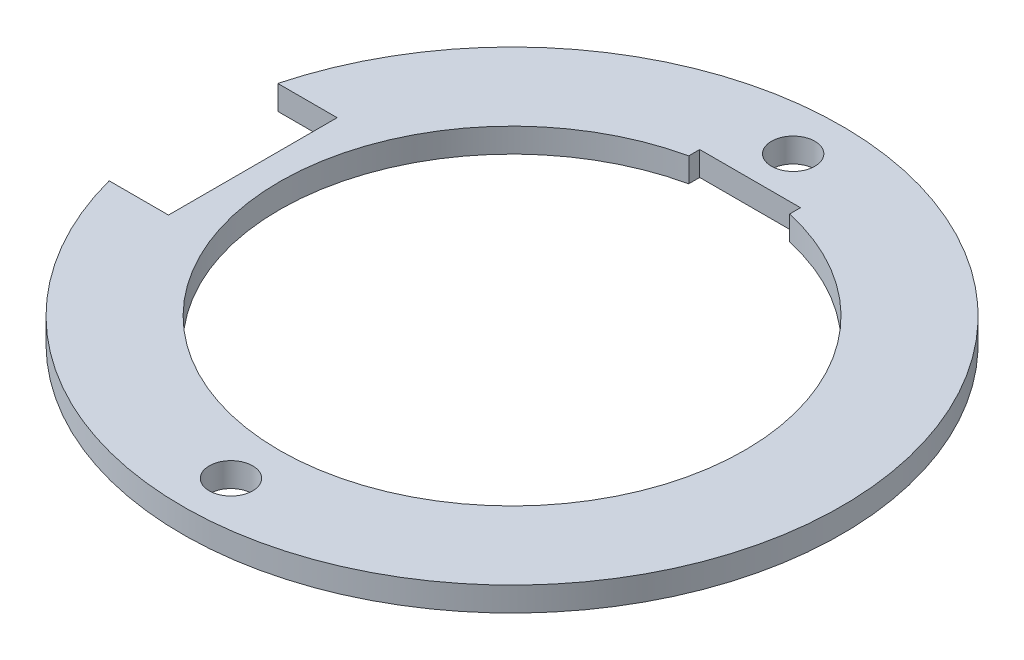
from build123d import *

# Parameters (mm, degrees)
SKETCH1_R           = 21.59
BOSS_EXTRUDE1_DEPTH = 0.79375
SKETCH2_R           = 1.4224
CUT_EXTRUDE1_DEPTH  = 31.574112518
CUT_EXTRUDE2_DEPTH  = 31.574112518


with BuildPart() as part:
    # Sketch1 → Boss-Extrude1 (new, symmetric)
    with BuildSketch(Plane(origin=(0, 0, 0), x_dir=(1, 0, 0), z_dir=(0, 1, 0))):
        with Locations(Location((0, 0, 0), (0, 0, 270))):
            Circle(SKETCH1_R)
        with BuildLine():
            Line((-3.302, 14.8779836), (-3.302, 15.5956))
            Line((-3.302, 15.5956), (3.302, 15.5956))
            Line((3.302, 15.5956), (3.302, 14.8779836))
            ThreePointArc((3.302, 14.8779836), (11.8865487, 9.537691545), (15.24, 0))
            ThreePointArc((15.24, 0), (-9.537691545, -11.8865487), (-3.302, 14.8779836))
        make_face(mode=Mode.SUBTRACT)
    extrude(amount=BOSS_EXTRUDE1_DEPTH, both=True)

    # Sketch2 → Cut-Extrude1 (cut, through all)
    with BuildSketch(Plane(origin=(0, 0.79375, 0), x_dir=(1, 0, 0), z_dir=(0, 1, 0))):
        with Locations(Location((0, 18.415, 0), (0, 0, 270))):
            Circle(SKETCH2_R)
        with Locations(Location((0, -18.415, 0), (0, 0, 270))):
            Circle(SKETCH2_R)
    extrude(amount=-CUT_EXTRUDE1_DEPTH, mode=Mode.SUBTRACT)

    # Sketch3 → Cut-Extrude2 (cut, through all)
    with BuildSketch(Plane(origin=(0, 0.79375, 0), x_dir=(1, 0, 0), z_dir=(0, 1, 0))):
        with BuildLine():
            Line((-20.871224203, 5.5245), (-16.984058744, 5.5245))
            Line((-16.984058744, 5.5245), (-16.984058744, -5.5245))
            Line((-16.984058744, -5.5245), (-20.871224203, -5.5245))
            ThreePointArc((-20.871224203, -5.5245), (-21.59, 0), (-20.871224203, 5.5245))
        make_face()
    extrude(amount=-CUT_EXTRUDE2_DEPTH, mode=Mode.SUBTRACT)


solid = part.part
